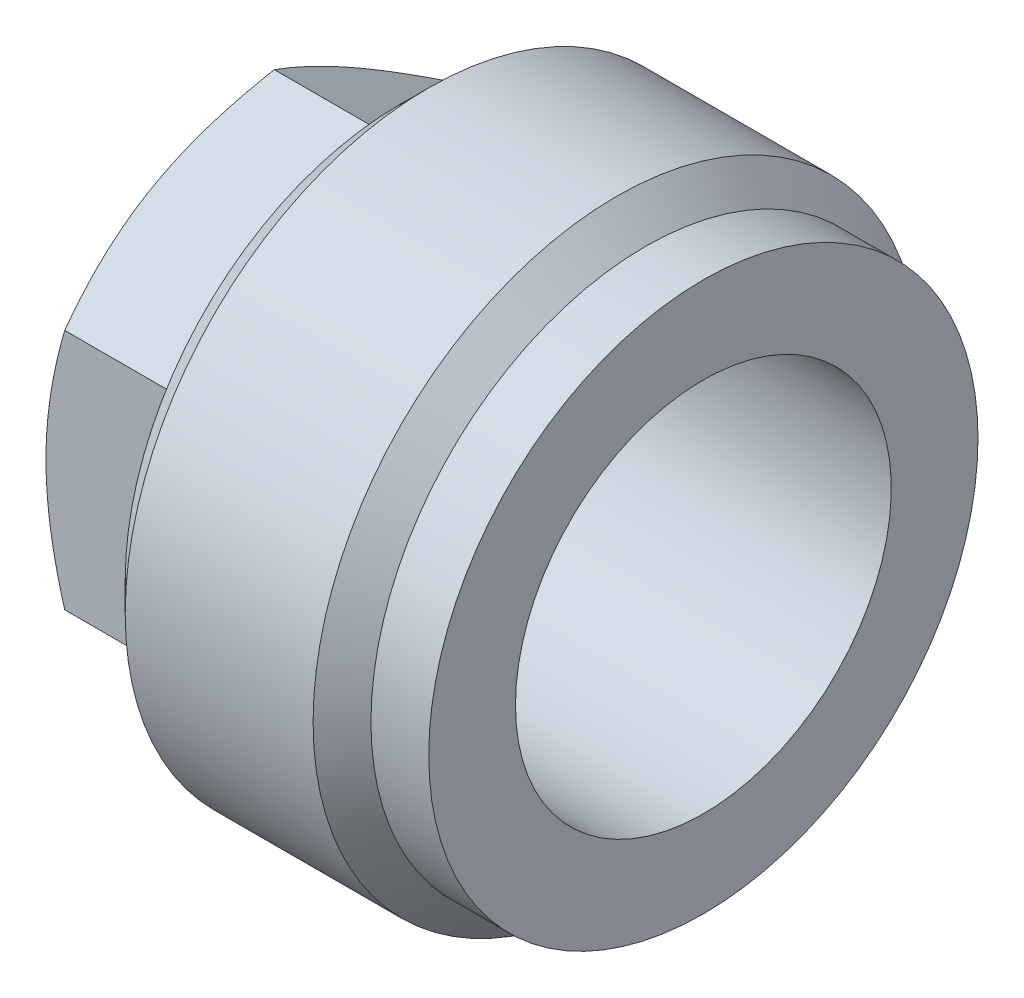
from build123d import *

# Parameters (mm, degrees)
CUT_EXTRUDE_START   = -12
SKETCH_2_R          = 17.5
CUT_EXTRUDE_1_DEPTH = 12
CHAMFER_1_SIZE      = 2
CHAMFER_2_SIZE      = 1.6


with BuildPart() as part:
    # Эскиз1 → Повернуть1 (revolve)
    with BuildSketch(Plane.XY, mode=Mode.PRIVATE) as revolve_1_sk:
        Polygon((0, -9.188), (0, -11), (3.75277675, -17.5), (12, -17.5), (12, -21), (27, -21), (29, -19), (33, -19), (33, -13), (13, -13), (13, -9.188), align=None)
    revolve(revolve_1_sk.sketch.rotate(Axis((0, 0, 0), (1, 0, 0)), 270), axis=Axis((0, 0, 0), (1, 0, 0)))

    # Эскиз2 → Вырез-Вытянуть1 (cut)
    with BuildSketch(Plane.ZY.offset(CUT_EXTRUDE_START)):
        Circle(SKETCH_2_R)
        Polygon((0, 16.743157806), (-14.5, 8.371578903), (-14.5, -8.371578903), (0, -16.743157806), (14.5, -8.371578903), (14.5, 8.371578903), align=None, mode=Mode.SUBTRACT)
    extrude(amount=CUT_EXTRUDE_1_DEPTH, mode=Mode.SUBTRACT)

    # Фаска1
    chamfer_1_edges = [part.edges().sort_by_distance(p)[0] for p in [
        (12, 0, -21),
    ]]
    chamfer(chamfer_1_edges, length=CHAMFER_1_SIZE)

    # Фаска2
    chamfer_2_edges = [part.edges().sort_by_distance(p)[0] for p in [
        (0, 0, -9.188),
    ]]
    chamfer(chamfer_2_edges, length=CHAMFER_2_SIZE)


solid = part.part
